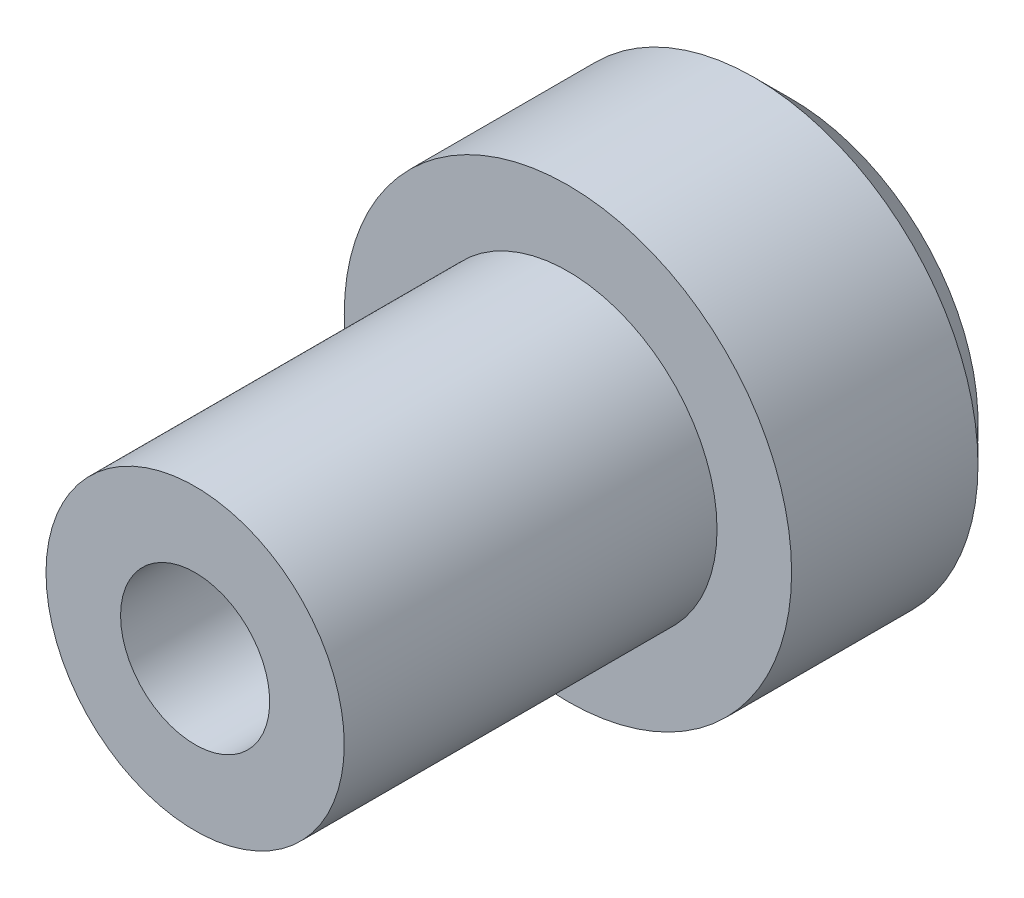
from build123d import *

# Parameters (mm, degrees)
SKETCH1_R           = 2
BOSS_EXTRUDE1_DEPTH = 5
SKETCH2_R           = 3
BOSS_EXTRUDE2_DEPTH = 3
CHAMFER1_SIZE       = 0.5
CUT_EXTRUDE3_DEPTH  = 1.5
SKETCH6_R           = 1
CUT_EXTRUDE4_DEPTH  = 8.762087348


with BuildPart() as part:
    # Sketch1 → Boss-Extrude1 (new body)
    with BuildSketch(Plane.XY):
        Circle(SKETCH1_R)
    extrude(amount=BOSS_EXTRUDE1_DEPTH)

    # Sketch2 → Boss-Extrude2 (add)
    with BuildSketch(Plane(origin=(0, 0, 0), x_dir=(-1, 0, 0), z_dir=(0, 0, -1))):
        Circle(SKETCH2_R)
    extrude(amount=BOSS_EXTRUDE2_DEPTH)

    # Chamfer1
    chamfer1_edges = [part.edges().sort_by_distance(p)[0] for p in [
        (3, 0, -3),
    ]]
    chamfer(chamfer1_edges, length=CHAMFER1_SIZE)

    # Sketch5 → Cut-Extrude3 (cut)
    with BuildSketch(Plane(origin=(0, 0, -3), x_dir=(-1, 0, 0), z_dir=(0, 0, -1))):
        Polygon((0, -1.154700538), (1, -0.577350269), (1, 0.577350269), (0, 1.154700538), (-1, 0.577350269), (-1, -0.577350269), align=None)
    extrude(amount=-CUT_EXTRUDE3_DEPTH, mode=Mode.SUBTRACT)

    # Sketch6 → Cut-Extrude4 (cut, through all)
    with BuildSketch(Plane(origin=(0, 0, -1.5), x_dir=(-1, 0, 0), z_dir=(0, 0, -1))):
        Circle(SKETCH6_R)
    extrude(amount=-CUT_EXTRUDE4_DEPTH, mode=Mode.SUBTRACT)


solid = part.part
